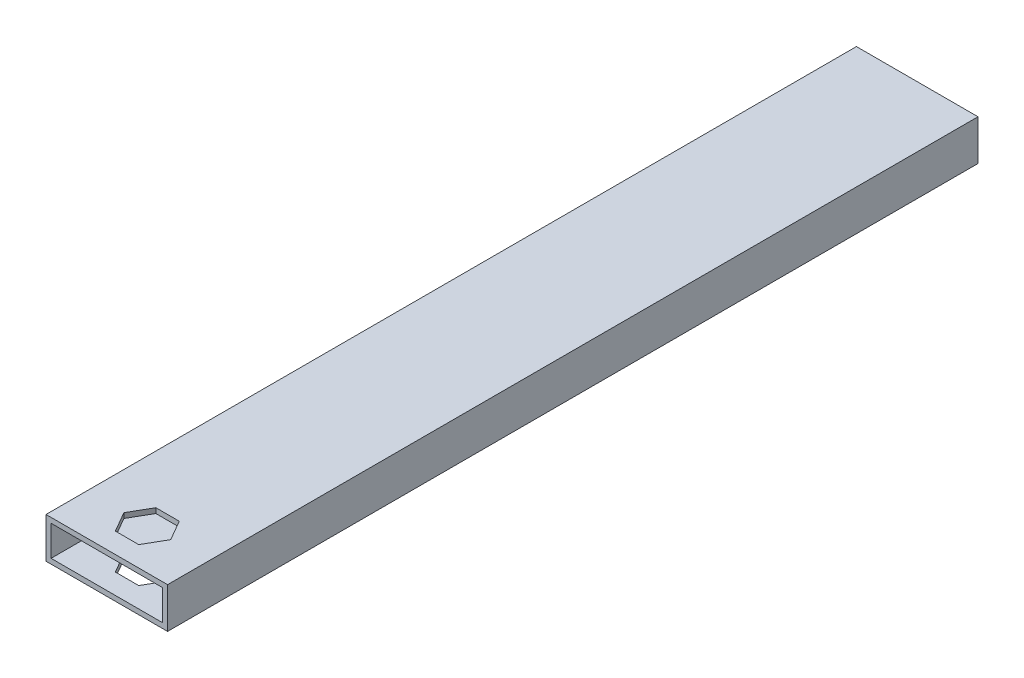
from build123d import *

# Parameters (mm, degrees)
SKETCH1_W           = 38.1
SKETCH1_H           = 12.7
BOSS_EXTRUDE1_DEPTH = 254
SKETCH2_W           = 34.925
SKETCH2_H           = 9.525
CUT_EXTRUDE1_DEPTH  = 258.155400488
CUT_EXTRUDE2_DEPTH  = 258.155400488


with BuildPart() as part:
    # Sketch1 → Boss-Extrude1 (new body)
    with BuildSketch(Plane.XY):
        with Locations((19.05, 6.35)):
            Rectangle(SKETCH1_W, SKETCH1_H)
    extrude(amount=BOSS_EXTRUDE1_DEPTH)

    # Sketch2 → Cut-Extrude1 (cut, through all)
    with BuildSketch(Plane.XY.offset(254)):
        with Locations((19.05, 6.35)):
            Rectangle(SKETCH2_W, SKETCH2_H)
    extrude(amount=-CUT_EXTRUDE1_DEPTH, mode=Mode.SUBTRACT)

    # Sketch3 → Cut-Extrude2 (cut, through all)
    with BuildSketch(Plane.XZ):
        Polygon((26.382348419, 241.3), (22.716174209, 247.65), (15.383825791, 247.65), (11.717651581, 241.3), (15.383825791, 234.95), (22.716174209, 234.95), align=None)
    extrude(amount=-CUT_EXTRUDE2_DEPTH, mode=Mode.SUBTRACT)


solid = part.part
